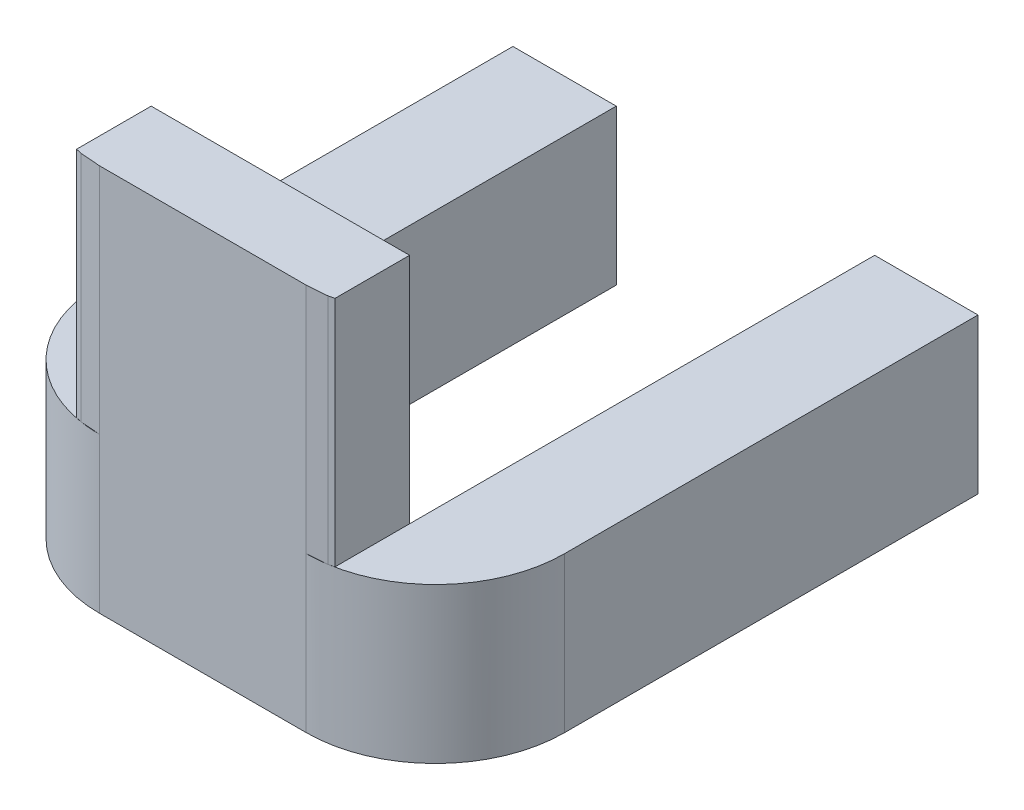
from build123d import *

# Parameters (mm, degrees)
BOSS_EXTRUDE1_DEPTH = 6
SKETCH4_R           = 1.5
CUT_EXTRUDE3_DEPTH  = 4
FILLET1_R           = 5
BOSS_EXTRUDE2_DEPTH = 15


with BuildPart() as part:
    # Sketch1 → Boss-Extrude1 (new body)
    with BuildSketch(Plane(origin=(0, 0, 0), x_dir=(1, 0, 0), z_dir=(0, 1, 0))):
        Polygon((9, 21), (9, 0), (-9, 0), (-9, 21), (-5, 21), (-5, 16), (-5, 3), (5, 3), (5, 16), (5, 21), align=None)
    extrude(amount=BOSS_EXTRUDE1_DEPTH)

    # Sketch4 → Cut-Extrude3 (cut)
    with BuildSketch(Plane(origin=(0, 0, -21), x_dir=(-1, 0, 0), z_dir=(0, 0, -1))):
        with Locations((7, 3)):
            Circle(SKETCH4_R)
        with Locations(Location((-7, 3, 0), (0, 0, 180))):
            Circle(SKETCH4_R)
    extrude(amount=-CUT_EXTRUDE3_DEPTH, mode=Mode.SUBTRACT)

    # Fillet1
    fillet1_edges = [part.edges().sort_by_distance(p)[0] for p in [
        (9, 3, 0),
        (-9, 3, 0),
    ]]
    fillet(fillet1_edges, radius=FILLET1_R)

    # Sketch5 → Boss-Extrude2 (add)
    with BuildSketch(Plane.XZ):
        Polygon((4, 0), (-4, 0), (-4.783910784, -0.061833956), (-5, -0.113226949), (-5, -3), (5, -3), (5, -0.113226949), (4.783910784, -0.061833956), align=None)
    extrude(amount=-BOSS_EXTRUDE2_DEPTH)


solid = part.part
